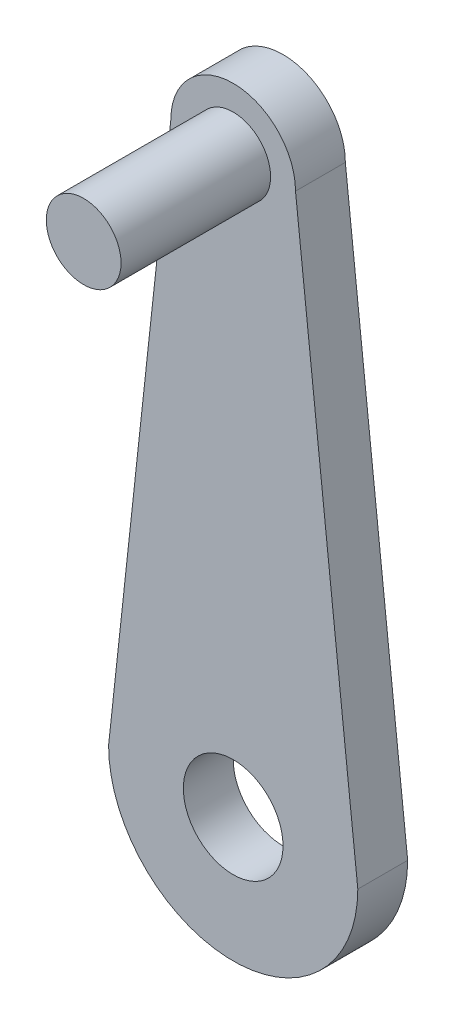
from build123d import *

# Parameters (mm, degrees)
SKETCH1_R           = 1.5
BOSS_EXTRUDE1_DEPTH = 2
SKETCH1_3_R         = 1.5
BOSS_EXTRUDE2_DEPTH = 8
SKETCH2_R           = 2
CUT_EXTRUDE1_DEPTH  = 10


with BuildPart() as part:
    # Sketch1 → Boss-Extrude1 (new body)
    with BuildSketch(Plane.XY):
        with BuildLine():
            Line((-4.883232135, 1.074264362), (-5, 0))
            ThreePointArc((-5, 0), (0, -5), (5, 0))
            Line((5, 0), (4.883232135, 1.074264362))
            Line((4.883232135, 1.074264362), (2.5, 23))
            ThreePointArc((2.5, 23), (0, 25.5), (-2.5, 23))
            Line((-2.5, 23), (-4.883232135, 1.074264362))
        make_face()
        with Locations((0, 23)):
            Circle(SKETCH1_R, mode=Mode.SUBTRACT)
    extrude(amount=BOSS_EXTRUDE1_DEPTH)

    # Sketch1<3> → Boss-Extrude2 (add)
    with BuildSketch(Plane.XY):
        with Locations((0, 23)):
            Circle(SKETCH1_3_R)
    extrude(amount=BOSS_EXTRUDE2_DEPTH)

    # Sketch2 → Cut-Extrude1 (cut)
    with BuildSketch(Plane.XY.offset(2)):
        Circle(SKETCH2_R)
    extrude(amount=-CUT_EXTRUDE1_DEPTH, mode=Mode.SUBTRACT)


solid = part.part
